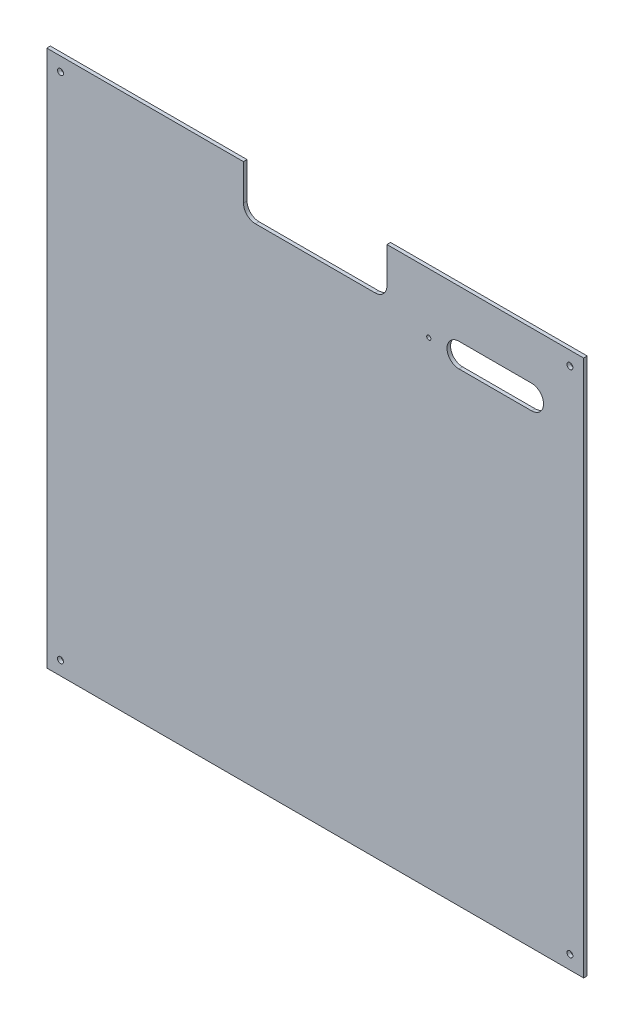
from build123d import *

# Parameters (mm, degrees)
SCHIZZO1_R                   = 2.5
SCHIZZO1_R_2                 = 1.75
ESTRUSIONE_ESTRUSIONE1_DEPTH = 3


with BuildPart() as part:
    # Schizzo1 → Estrusione-Estrusione1 (new body)
    with BuildSketch(Plane.XY):
        with BuildLine():
            Line((0, 0), (0, 449))
            Line((0, 449), (164.5, 449))
            Line((164.5, 449), (164.5, 419))
            ThreePointArc((164.5, 419), (167.428932188, 411.928932188), (174.5, 409))
            Line((174.5, 409), (274.5, 409))
            ThreePointArc((274.5, 409), (281.571067812, 411.928932188), (284.5, 419))
            Line((284.5, 419), (284.5, 449))
            Line((284.5, 449), (449, 449))
            Line((449, 449), (449, 0))
            Line((449, 0), (0, 0))
        make_face()
        with Locations((11.5, 11.5)):
            Circle(SCHIZZO1_R, mode=Mode.SUBTRACT)
        with Locations(Location((437.5, 11.5, 0), (0, 0, 180))):
            Circle(SCHIZZO1_R, mode=Mode.SUBTRACT)
        with Locations((437.5, 437.5)):
            Circle(SCHIZZO1_R, mode=Mode.SUBTRACT)
        with Locations(Location((11.5, 437.5, 0), (0, 0, 180))):
            Circle(SCHIZZO1_R, mode=Mode.SUBTRACT)
        with Locations((319.5, 399)):
            Circle(SCHIZZO1_R_2, mode=Mode.SUBTRACT)
        with BuildLine():
            Line((344.715899345, 409), (405.440355678, 409))
            ThreePointArc((405.440355678, 409), (415.440355678, 399), (405.440355678, 389))
            Line((405.440355678, 389), (344.715899345, 389))
            ThreePointArc((344.715899345, 389), (334.715899345, 399), (344.715899345, 409))
        make_face(mode=Mode.SUBTRACT)
    extrude(amount=ESTRUSIONE_ESTRUSIONE1_DEPTH)


solid = part.part
